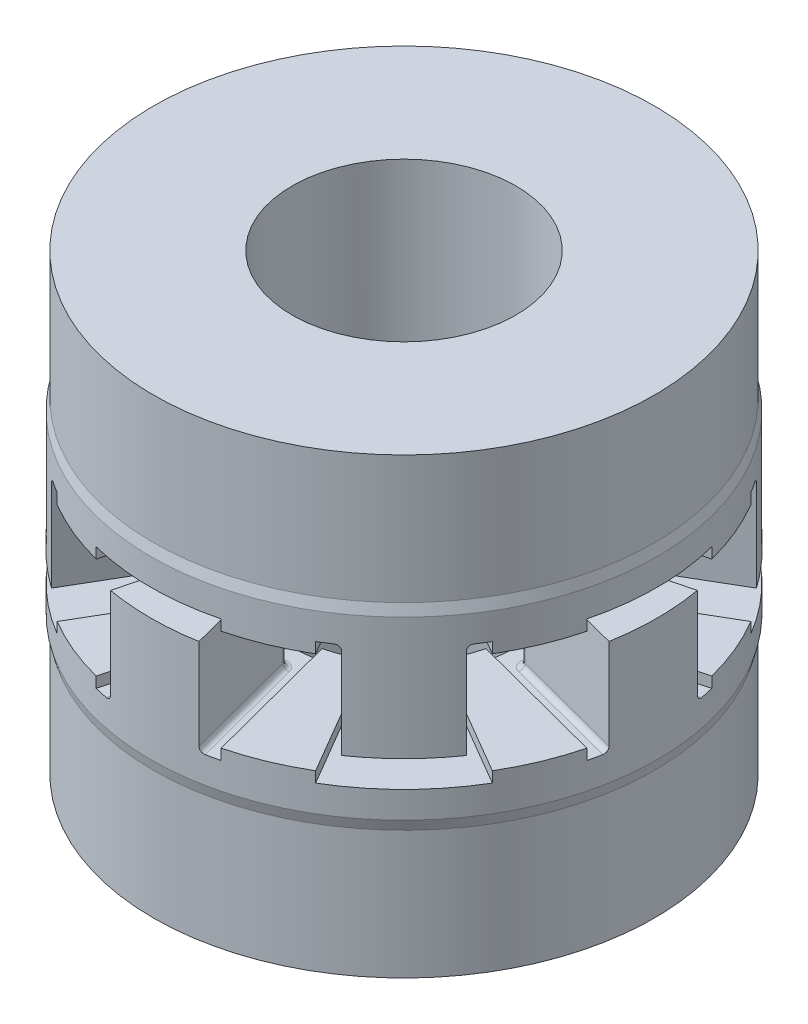
from build123d import *
from build123d.topology import SkipClean

# Parameters (mm, degrees)
CORTE_EXTRUS_O1_DEPTH     = 18
PADR_OCIRCULAR1_COUNT     = 4
ESBO_O3_R                 = 24.75
CORTE_EXTRUS_O2_DEPTH     = 18
RESSALTO_EXTRUS_O1_DEPTH  = 2
FILETE2_R                 = 1
FILETE3_R                 = 1
CORPO_MOVER_COPIAR1_ANGLE = 45


with BuildPart() as part:
    # Esboço1 → Revolução1 (revolve)
    with BuildSketch(Plane.XY, mode=Mode.PRIVATE) as revolu_o1_sk:
        Polygon((-21, 0), (-47, 0), (-47, 24), (-47.5, 26), (-47.5, 49), (-21, 49), align=None)
    revolve(revolu_o1_sk.sketch.rotate(Axis((0, 49.042207792, 0), (0, -1, 0)), 270), axis=Axis((0, 49.042207792, 0), (0, -1, 0)))

    # Esboço2 → Corte-extrusão1 (cut)
    with BuildSketch(Plane(origin=(0, 49, 0), x_dir=(1, 0, 0), z_dir=(0, 1, 0))):
        with BuildLine():
            Line((-8.3, 46.769220648), (-2.5, 24.623413654))
            ThreePointArc((-2.5, 24.623413654), (-17.500892834, 17.500892834), (-24.623413654, 2.5))
            Line((-24.623413654, 2.5), (-46.769220648, 8.3))
            ThreePointArc((-46.769220648, 8.3), (-33.587572106, 33.587572106), (-8.3, 46.769220648))
        make_face()
    corte_extrus_o1 = extrude(amount=-CORTE_EXTRUS_O1_DEPTH, mode=Mode.SUBTRACT)

    # PadrãoCircular1: Corte-extrusão1 ×4 about axis
    padr_ocircular1_axis = Axis((0, 0, 0), (0, 1, 0))
    for i in range(1, PADR_OCIRCULAR1_COUNT):
        add(corte_extrus_o1.rotate(padr_ocircular1_axis, i * 360 / PADR_OCIRCULAR1_COUNT), mode=Mode.SUBTRACT)

    # Esboço3 → Corte-extrusão2 (cut)
    with BuildSketch(Plane(origin=(0, 49, 0), x_dir=(1, 0, 0), z_dir=(0, 1, 0))):
        Circle(ESBO_O3_R)
    extrude(amount=-CORTE_EXTRUS_O2_DEPTH, mode=Mode.SUBTRACT)

    # Esboço4 → Ressalto-extrusão1 (add)
    with SkipClean():  # the faces are left unmerged after this step: merging them gives an invalid solid
        with BuildSketch(Plane(origin=(0, 31, 0), x_dir=(1, 0, 0), z_dir=(0, 1, 0))):
            with BuildLine():
                Line((-5.01024501, 20.393563812), (-11.724513648, 46.030270255))
                ThreePointArc((-11.724513648, 46.030270255), (-18.177463037, 43.884277794), (-24.25783313, 40.838799344))
                Line((-24.25783313, 40.838799344), (-10.877649042, 17.963205486))
                ThreePointArc((-10.877649042, 17.963205486), (-8.03635208, 19.401470183), (-5.01024501, 20.393563812))
            make_face()
            with BuildLine():
                Line((11.724513648, 46.030270255), (5.01024501, 20.393563812))
                ThreePointArc((5.01024501, 20.393563812), (8.03635208, 19.401470183), (10.877649042, 17.963205486))
                Line((10.877649042, 17.963205486), (24.25783313, 40.838799344))
                ThreePointArc((24.25783313, 40.838799344), (18.177463037, 43.884277794), (11.724513648, 46.030270255))
            make_face()
            with BuildLine():
                ThreePointArc((-20.393563812, 5.01024501), (-19.401470183, 8.03635208), (-17.963205486, 10.877649042))
                Line((-17.963205486, 10.877649042), (-40.838799344, 24.25783313))
                ThreePointArc((-40.838799344, 24.25783313), (-43.884277794, 18.177463037), (-46.030270255, 11.724513648))
                Line((-46.030270255, 11.724513648), (-20.393563812, 5.01024501))
            make_face()
            with BuildLine():
                Line((40.838799344, 24.25783313), (17.963205486, 10.877649042))
                ThreePointArc((17.963205486, 10.877649042), (19.401470183, 8.03635208), (20.393563812, 5.01024501))
                Line((20.393563812, 5.01024501), (46.030270255, 11.724513648))
                ThreePointArc((46.030270255, 11.724513648), (43.884277794, 18.177463037), (40.838799344, 24.25783313))
            make_face()
            with BuildLine():
                ThreePointArc((-17.963205486, -10.877649042), (-19.401470183, -8.03635208), (-20.393563812, -5.01024501))
                Line((-20.393563812, -5.01024501), (-46.030270255, -11.724513648))
                ThreePointArc((-46.030270255, -11.724513648), (-43.884277794, -18.177463037), (-40.838799344, -24.25783313))
                Line((-40.838799344, -24.25783313), (-17.963205486, -10.877649042))
            make_face()
            with BuildLine():
                Line((46.030270255, -11.724513648), (20.393563812, -5.01024501))
                ThreePointArc((20.393563812, -5.01024501), (19.401470183, -8.03635208), (17.963205486, -10.877649042))
                Line((17.963205486, -10.877649042), (40.838799344, -24.25783313))
                ThreePointArc((40.838799344, -24.25783313), (43.884277794, -18.177463037), (46.030270255, -11.724513648))
            make_face()
            with BuildLine():
                ThreePointArc((-5.01024501, -20.393563812), (-8.03635208, -19.401470183), (-10.877649042, -17.963205486))
                Line((-10.877649042, -17.963205486), (-24.25783313, -40.838799344))
                ThreePointArc((-24.25783313, -40.838799344), (-18.177463037, -43.884277794), (-11.724513648, -46.030270255))
                Line((-11.724513648, -46.030270255), (-5.01024501, -20.393563812))
            make_face()
            with BuildLine():
                Line((24.25783313, -40.838799344), (10.877649042, -17.963205486))
                ThreePointArc((10.877649042, -17.963205486), (8.03635208, -19.401470183), (5.01024501, -20.393563812))
                Line((5.01024501, -20.393563812), (11.724513648, -46.030270255))
                ThreePointArc((11.724513648, -46.030270255), (18.177463037, -43.884277794), (24.25783313, -40.838799344))
            make_face()
        extrude(amount=RESSALTO_EXTRUS_O1_DEPTH)

    # Filete2
    filete2_edges = [part.edges().sort_by_distance(p)[0] for p in [
        (-2.5, 40, -24.623413654),
        (-24.623413654, 40, -2.5),
        (-24.623413654, 40, 2.5),
        (-2.5, 40, 24.623413654),
        (2.5, 40, 24.623413654),
        (24.623413654, 40, 2.5),
        (24.623413654, 40, -2.5),
        (2.5, 40, -24.623413654),
    ]]
    fillet(filete2_edges, radius=FILETE2_R)

    # Filete3
    filete3_edges = [part.edges().sort_by_distance(p)[0] for p in [
        (-36.103307668, 31, -5.506591058),
        (5.506591058, 31, 36.103307668),
        (0, 31, 24.75),
        (-36.103307668, 31, 5.506591058),
        (-24.75, 31, 0),
        (24.75, 31, 0),
        (36.103307668, 31, -5.506591058),
        (0, 31, -24.75),
        (-5.506591058, 31, -36.103307668),
        (2.329607235, 31, 24.8788516),
        (-2.329607235, 31, 24.8788516),
        (-24.8788516, 31, 2.329607235),
        (-24.8788516, 31, -2.329607235),
        (24.8788516, 31, 2.329607235),
        (24.8788516, 31, -2.329607235),
        (2.329607235, 31, -24.8788516),
        (-2.329607235, 31, -24.8788516),
        (-5.506591058, 31, 36.103307668),
        (36.103307668, 31, 5.506591058),
        (5.506591058, 31, -36.103307668),
    ]]
    fillet(filete3_edges, radius=FILETE3_R)


with BuildPart() as body_2:
    # Espelhar1: mirrored copy
    add(part.part.mirror(Plane(origin=(0, 42.5, 0), x_dir=(0, 0, 1), z_dir=(0, -1, 0))))


with BuildPart() as body_2_1:
    # Corpo-Mover/Copiar1: moved
    add(body_2.part.rotate(Axis((0, 0, 0), (0, 1, 0)), CORPO_MOVER_COPIAR1_ANGLE))


solid = Compound([part.part, body_2_1.part])
